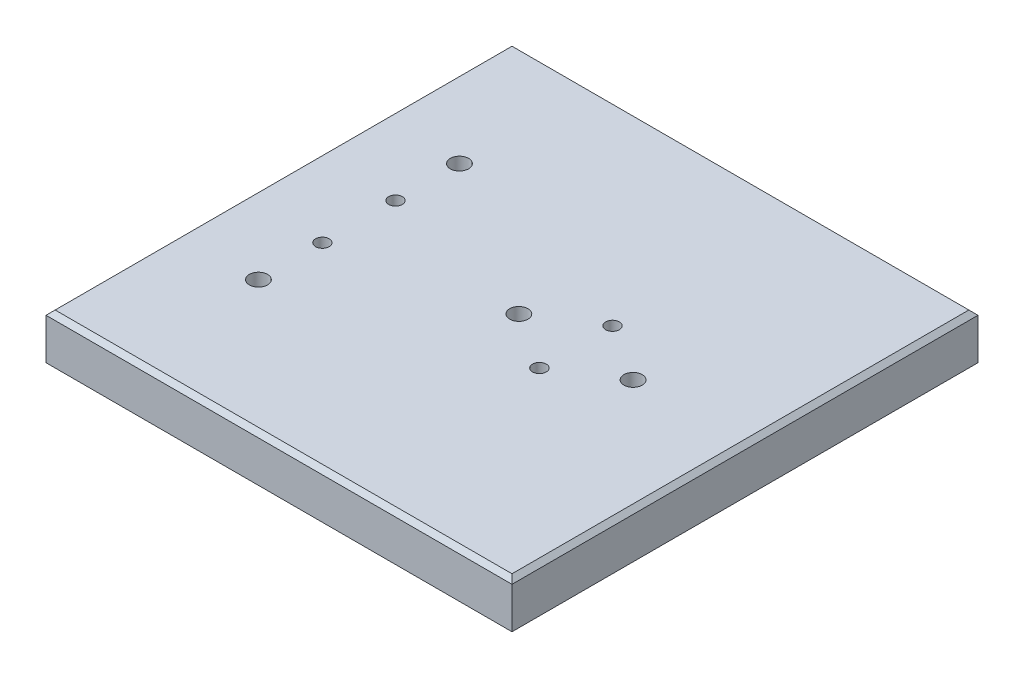
from build123d import *

# Parameters (mm, degrees)
IZIM1_W                     = 102
IZIM1_H                     = 102
Y_KSEKLIK_EKSTR_ZYON1_DEPTH = 10
IZIM4_R                     = 2.5
KES_EKSTR_ZYON1_DEPTH       = 9.5
IZIM5_R                     = 1.5
KES_EKSTR_ZYON2_DEPTH       = 58
IZIM6_R                     = 3.5
KES_EKSTR_ZYON9_DEPTH       = 5
IZIM9_R                     = 2
KES_EKSTR_ZYON10_DEPTH      = 5
IZIM10_R                    = 1.5
KES_EKSTR_ZYON18_DEPTH      = 8
PAH1_SIZE                   = 1


with BuildPart() as part:
    # Çizim1 → Yükseklik-Ekstrüzyon1 (new body)
    with BuildSketch(Plane(origin=(0, 0, 0), x_dir=(1, 0, 0), z_dir=(0, 1, 0))):
        Rectangle(IZIM1_W, IZIM1_H)
    extrude(amount=Y_KSEKLIK_EKSTR_ZYON1_DEPTH)

    # Çizim4 → Kes-Ekstrüzyon1 (cut)
    with BuildSketch(Plane.ZY.offset(51)):
        with Locations((-8, 5)):
            Circle(IZIM4_R)
        with Locations((8, 5)):
            Circle(IZIM4_R)
    extrude(amount=-KES_EKSTR_ZYON1_DEPTH, mode=Mode.SUBTRACT)

    # Çizim5 → Kes-Ekstrüzyon2 (cut)
    with BuildSketch(Plane.ZY.offset(41.5)):
        with Locations((-8, 5)):
            Circle(IZIM5_R)
        with Locations((8, 5)):
            Circle(IZIM5_R)
    extrude(amount=-KES_EKSTR_ZYON2_DEPTH, mode=Mode.SUBTRACT)

    # Çizim6 → Kes-Ekstrüzyon9 (cut)
    with BuildSketch(Plane(origin=(0, 0, 0), x_dir=(-1, 0, 0), z_dir=(0, -1, 0))):
        with Locations(Location((33.5, -22, 0), (0, 0, 90))):
            Circle(IZIM6_R)
        with Locations(Location((33.5, 22, 0), (0, 0, 90))):
            Circle(IZIM6_R)
        with Locations(Location((-1.5, 0, 0), (0, 0, 90))):
            Circle(IZIM6_R)
        with Locations(Location((-26.5, 0, 0), (0, 0, 90))):
            Circle(IZIM6_R)
    extrude(amount=-KES_EKSTR_ZYON9_DEPTH, mode=Mode.SUBTRACT)

    # Çizim9 → Kes-Ekstrüzyon10 (cut)
    with BuildSketch(Plane.XZ.offset(-5)):
        with Locations(Location((-33.5, 22, 0), (0, 0, 270))):
            Circle(IZIM9_R)
        with Locations(Location((1.5, 0, 0), (0, 0, 270))):
            Circle(IZIM9_R)
        with Locations(Location((26.5, 0, 0), (0, 0, 270))):
            Circle(IZIM9_R)
        with Locations(Location((-33.5, -22, 0), (0, 0, 270))):
            Circle(IZIM9_R)
    extrude(amount=-KES_EKSTR_ZYON10_DEPTH, mode=Mode.SUBTRACT)

    # Çizim10 → Kes-Ekstrüzyon18 (cut)
    with BuildSketch(Plane(origin=(0, 10, 0), x_dir=(1, 0, 0), z_dir=(0, 1, 0))):
        with Locations(Location((-33.5, 8, 0), (0, 0, 270))):
            Circle(IZIM10_R)
        with Locations(Location((-33.5, -8, 0), (0, 0, 90))):
            Circle(IZIM10_R)
        with Locations(Location((14, 8, 0), (0, 0, 270))):
            Circle(IZIM10_R)
        with Locations(Location((14, -8, 0), (0, 0, 270))):
            Circle(IZIM10_R)
    extrude(amount=-KES_EKSTR_ZYON18_DEPTH, mode=Mode.SUBTRACT)

    # Pah1
    pah1_edges = [part.edges().sort_by_distance(p)[0] for p in [
        (-51, 10, 0),
        (0, 10, 51),
        (51, 10, 0),
        (0, 10, -51),
    ]]
    chamfer(pah1_edges, length=PAH1_SIZE)


solid = part.part
